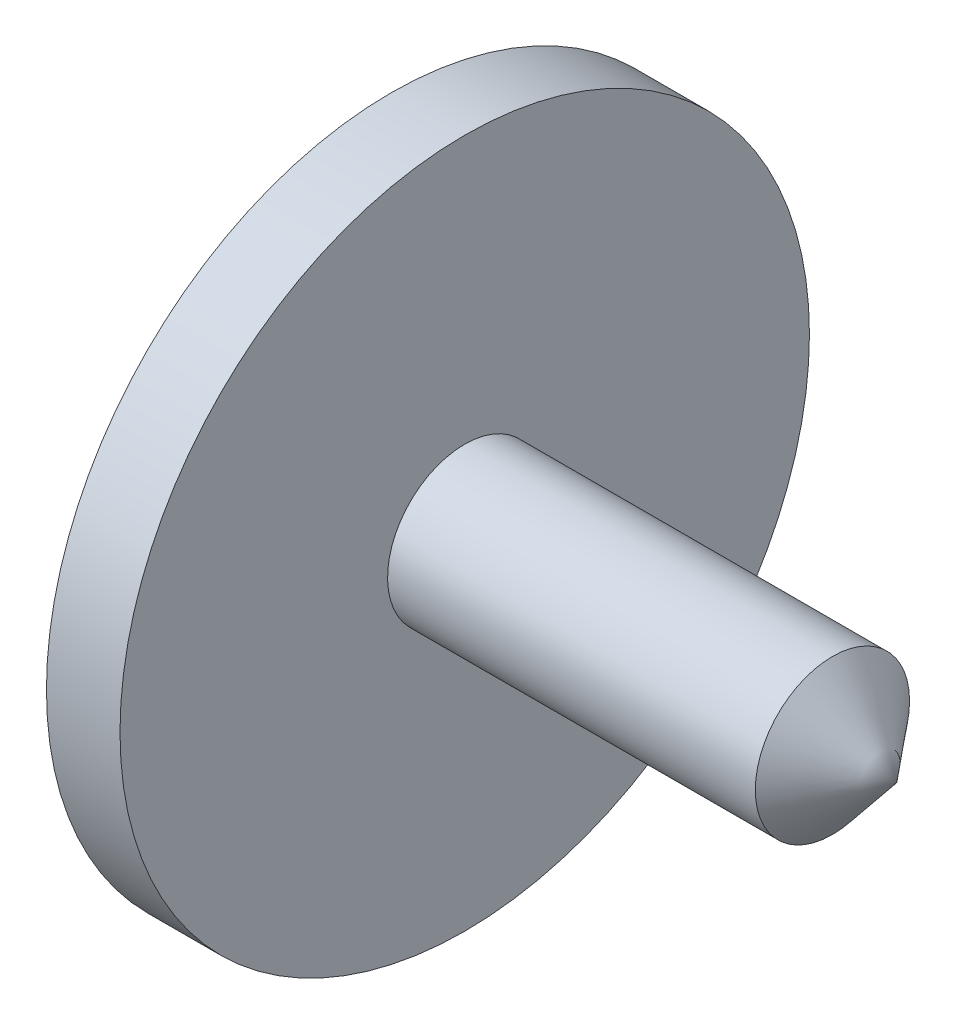
from build123d import *


with BuildPart() as part:
    # 草图1 → 旋转1 (revolve)
    with BuildSketch(Plane.XY):
        Polygon((0, 0), (0, 37.5), (8, 37.5), (8, 8.390410959), (48, 8.390410959), (55, 0), align=None)
    revolve(axis=Axis((55, 0, 0), (-1, 0, 0)))


solid = part.part
